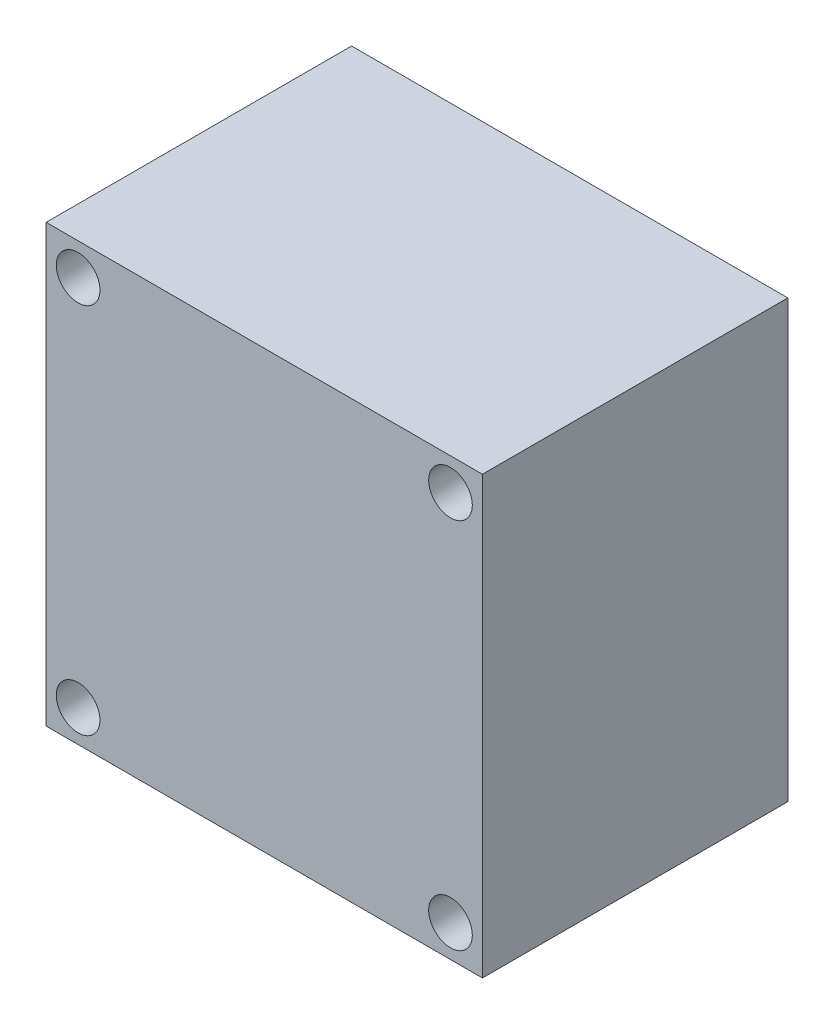
from build123d import *

# Parameters (mm, degrees)
SKETCH1_W           = 40
SKETCH1_H           = 40
BOSS_EXTRUDE1_DEPTH = 28
SKETCH2_R           = 2
CUT_EXTRUDE1_DEPTH  = 40.799497484


with BuildPart() as part:
    # Sketch1 → Boss-Extrude1 (new body)
    with BuildSketch(Plane.XY):
        Rectangle(SKETCH1_W, SKETCH1_H)
    extrude(amount=BOSS_EXTRUDE1_DEPTH)

    # Sketch2 → Cut-Extrude1 (cut, through all)
    with BuildSketch(Plane.XY.offset(28)):
        with Locations((-17.071067812, 17.071067812)):
            Circle(SKETCH2_R)
        with Locations((-17.071067812, -17.071067812)):
            Circle(SKETCH2_R)
        with Locations((17.071067812, 17.071067812)):
            Circle(SKETCH2_R)
        with Locations((17.071067812, -17.071067812)):
            Circle(SKETCH2_R)
    extrude(amount=-CUT_EXTRUDE1_DEPTH, mode=Mode.SUBTRACT)


solid = part.part
